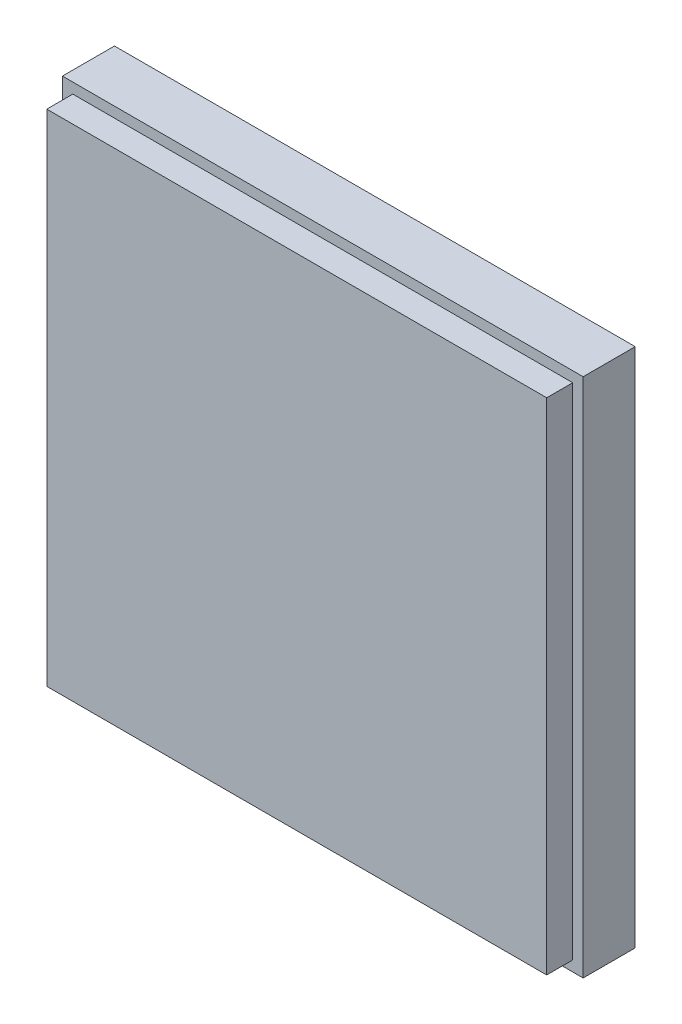
from build123d import *

# Parameters (mm, degrees)
SKETCH2_W           = 100
SKETCH2_H           = 100
BOSS_EXTRUDE1_DEPTH = 10
SKETCH4_W           = 96
SKETCH4_H           = 96
BOSS_EXTRUDE2_DEPTH = 5


with BuildPart() as part:
    # Sketch2 → Boss-Extrude1 (new body)
    with BuildSketch(Plane.XY):
        with Locations((-3.066812705, -17.798466594)):
            Rectangle(SKETCH2_W, SKETCH2_H)
    extrude(amount=BOSS_EXTRUDE1_DEPTH)

    # Sketch4 → Boss-Extrude2 (add)
    with BuildSketch(Plane.XY.offset(10)):
        with Locations((-3.066812705, -17.798466594)):
            Rectangle(SKETCH4_W, SKETCH4_H)
    extrude(amount=BOSS_EXTRUDE2_DEPTH)


solid = part.part
